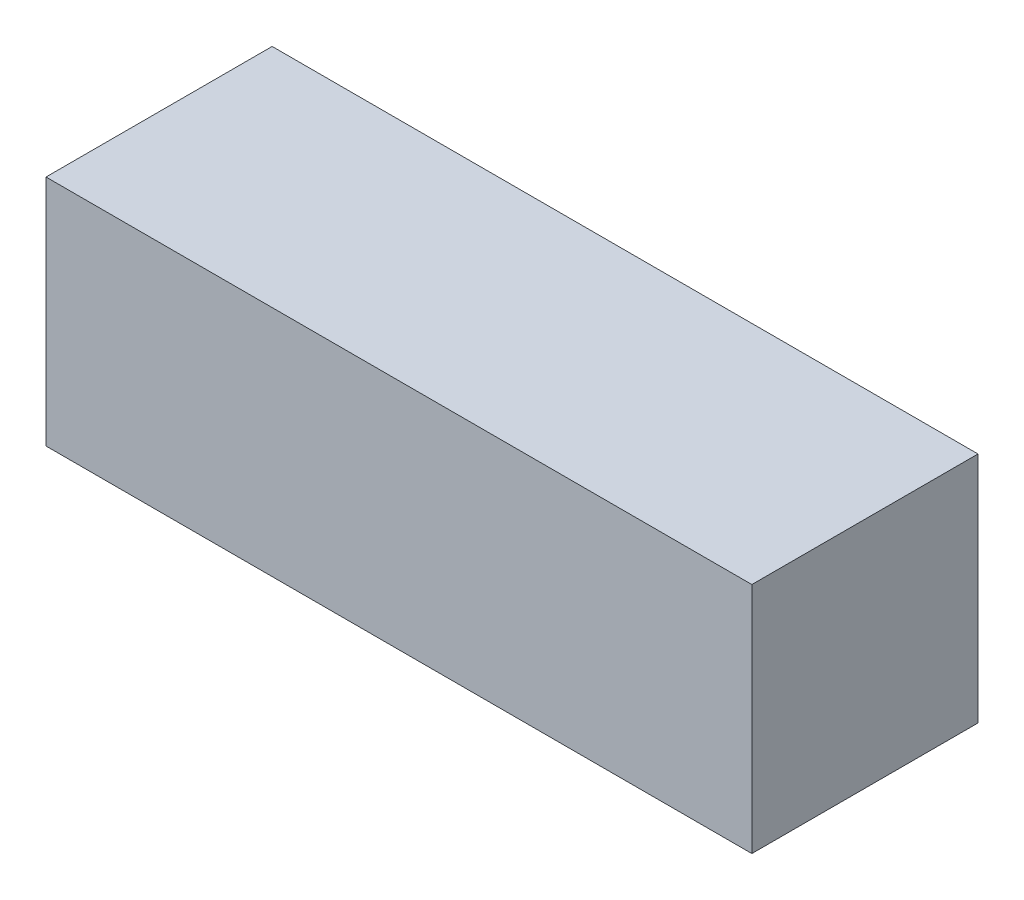
from build123d import *

# Parameters (mm, degrees)
SKETCH1_W           = 103
SKETCH1_H           = 33
BOSS_EXTRUDE1_DEPTH = 34


with BuildPart() as part:
    # Sketch1 → Boss-Extrude1 (new body)
    with BuildSketch(Plane(origin=(0, 0, 0), x_dir=(1, 0, 0), z_dir=(0, 1, 0))):
        with Locations((51.5, 16.5)):
            Rectangle(SKETCH1_W, SKETCH1_H)
    extrude(amount=BOSS_EXTRUDE1_DEPTH)


solid = part.part
